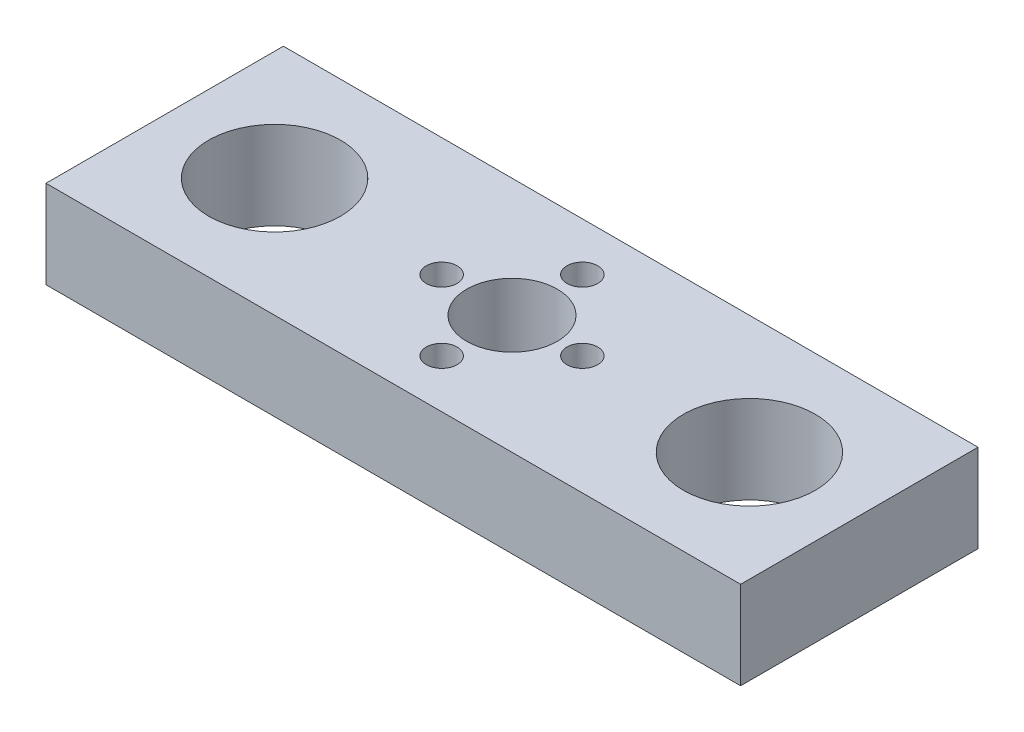
from build123d import *

# Parameters (mm, degrees)
SKETCH_1_W          = 79
SKETCH_1_H          = 27
EXTRUDE_1_DEPTH     = 10
SKETCH_3_R          = 7.5
CUT_EXTRUDE_1_DEPTH = 43.924352063
SKETCH_4_R          = 5.15
CUT_EXTRUDE_2_DEPTH = 43.924352063
SKETCH_5_R          = 1.75
CUT_EXTRUDE_3_DEPTH = 43.924352063


with BuildPart() as part:
    # 草图1 → 凸台-拉伸1 (new body)
    with BuildSketch(Plane(origin=(0, 0, 0), x_dir=(1, 0, 0), z_dir=(0, 1, 0))):
        Rectangle(SKETCH_1_W, SKETCH_1_H)
    extrude(amount=EXTRUDE_1_DEPTH)

    # 草图3 → 切除-拉伸1 (cut, through all)
    with BuildSketch(Plane(origin=(0, 10, 0), x_dir=(1, 0, 0), z_dir=(0, 1, 0))):
        with Locations(Location((-27, 0, 0), (0, 0, 270))):
            Circle(SKETCH_3_R)
        with Locations(Location((27, 0, 0), (0, 0, 270))):
            Circle(SKETCH_3_R)
    extrude(amount=-CUT_EXTRUDE_1_DEPTH, mode=Mode.SUBTRACT)

    # 草图4 → 切除-拉伸2 (cut, through all)
    with BuildSketch(Plane(origin=(0, 10, 0), x_dir=(1, 0, 0), z_dir=(0, 1, 0))):
        with Locations(Location((0, 0, 0), (0, 0, 270))):
            Circle(SKETCH_4_R)
    extrude(amount=-CUT_EXTRUDE_2_DEPTH, mode=Mode.SUBTRACT)

    # 草图5 → 切除-拉伸3 (cut, through all)
    with BuildSketch(Plane(origin=(0, 10, 0), x_dir=(1, 0, 0), z_dir=(0, 1, 0))):
        with Locations(Location((8, 0, 0), (0, 0, 270))):
            Circle(SKETCH_5_R)
        with Locations(Location((0, -8, 0), (0, 0, 270))):
            Circle(SKETCH_5_R)
        with Locations(Location((-8, 0, 0), (0, 0, 270))):
            Circle(SKETCH_5_R)
        with Locations(Location((0, 8, 0), (0, 0, 270))):
            Circle(SKETCH_5_R)
    extrude(amount=-CUT_EXTRUDE_3_DEPTH, mode=Mode.SUBTRACT)


solid = part.part
